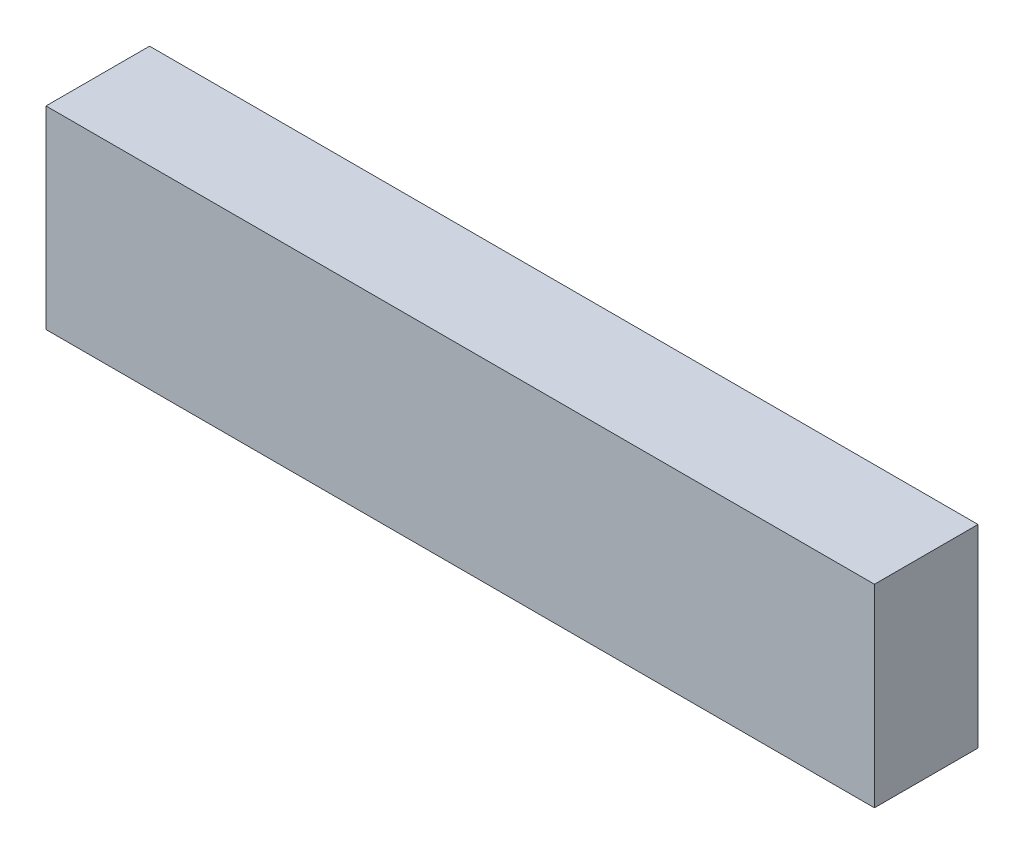
from build123d import *

# Parameters (mm, degrees)
SKETCH1_W           = 50.8
SKETCH1_H           = 6.35
BOSS_EXTRUDE1_DEPTH = 11.875


with BuildPart() as part:
    # Sketch1 → Boss-Extrude1 (new body)
    with BuildSketch(Plane(origin=(0, 0, 0), x_dir=(1, 0, 0), z_dir=(0, 1, 0))):
        with Locations((25.4, -3.175)):
            Rectangle(SKETCH1_W, SKETCH1_H)
    extrude(amount=BOSS_EXTRUDE1_DEPTH)


solid = part.part
